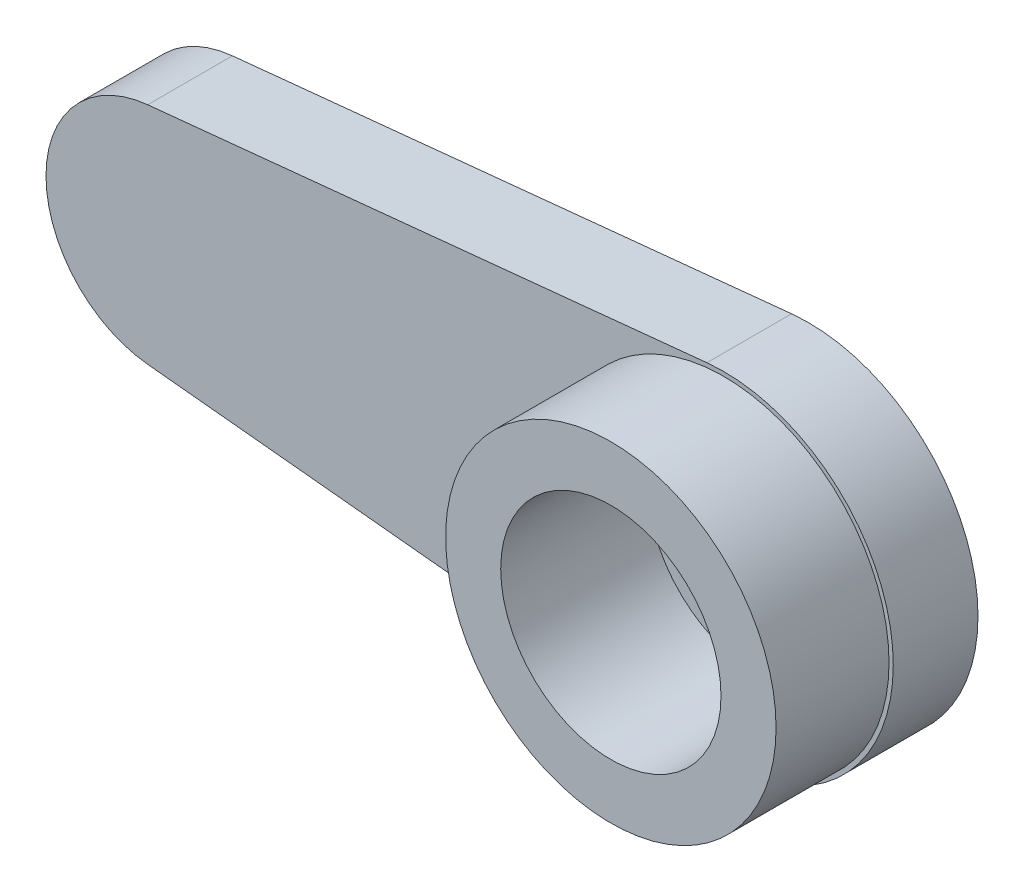
from build123d import *

# Parameters (mm, degrees)
EXTRUSION1_DEPTH = 1.5
ESQUISSE2_R      = 2.925
EXTRUSION2_DEPTH = 2
ESQUISSE3_R      = 0.9
EXTRUSION3_DEPTH = 10.253328027
ESQUISSE4_R      = 1.95
EXTRUSION4_DEPTH = 2.6


with BuildPart() as part:
    # Esquisse1 → Extrusion1 (new body)
    with BuildSketch(Plane.XY):
        with BuildLine():
            Line((-5.176654091, 1.989974874), (4.723345909, 2.984962311))
            ThreePointArc((4.723345909, 2.984962311), (8.023345909, 0), (4.723345909, -2.984962311))
            Line((4.723345909, -2.984962311), (-5.176654091, -1.989974874))
            ThreePointArc((-5.176654091, -1.989974874), (-6.976654091, 0), (-5.176654091, 1.989974874))
        make_face()
    extrude(amount=EXTRUSION1_DEPTH)

    # Esquisse2 → Extrusion2 (add)
    with BuildSketch(Plane.XY.offset(1.5)):
        with Locations((5.023345909, 0)):
            Circle(ESQUISSE2_R)
    extrude(amount=EXTRUSION2_DEPTH)

    # Esquisse3 → Extrusion3 (cut, through all)
    with BuildSketch(Plane.XY.offset(3.5)):
        with Locations((5.023345909, 0)):
            Circle(ESQUISSE3_R)
    extrude(amount=-EXTRUSION3_DEPTH, mode=Mode.SUBTRACT)

    # Esquisse4 → Extrusion4 (cut)
    with BuildSketch(Plane.XY.offset(3.5)):
        with Locations((5.023345909, 0)):
            Circle(ESQUISSE4_R)
    extrude(amount=-EXTRUSION4_DEPTH, mode=Mode.SUBTRACT)


solid = part.part
